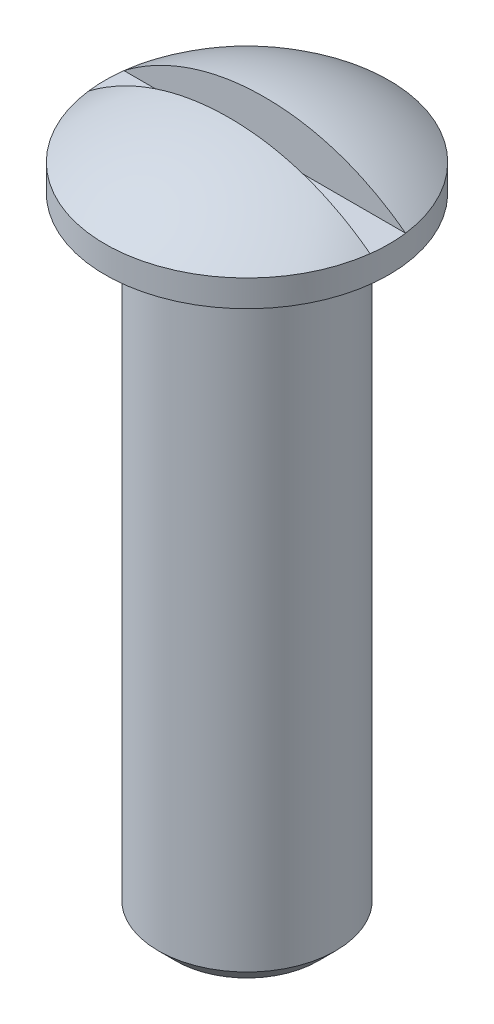
from build123d import *

# Parameters (mm, degrees)
SFAZOWANIE1_SIZE           = 1
SZKIC5_W                   = 16
SZKIC5_H                   = 2
WYTNIJ_WYCI_GNI_CIE7_DEPTH = 39.691084286


with BuildPart() as part:
    # Szkic1 → Obrót1 (revolve)
    with BuildSketch(Plane.XY):
        with BuildLine():
            Line((0, 0), (5, 0))
            Line((5, 0), (5, 35.5))
            Line((5, 35.5), (8, 35.5))
            Line((8, 35.5), (8, 37))
            ThreePointArc((8, 37), (4.225307725, 39.017578445), (0, 39.7))
            Line((0, 39.7), (0, 0))
        make_face()
    revolve(axis=Axis((0, 0, 0), (0, 1, 0)))

    # Sfazowanie1
    sfazowanie1_edges = [part.edges().sort_by_distance(p)[0] for p in [
        (-5, 0, 0),
    ]]
    chamfer(sfazowanie1_edges, length=SFAZOWANIE1_SIZE)

    # Szkic5 → Wytnij-wyciągnięcie7 (cut, through all)
    with BuildSketch(Plane(origin=(0, 37, 0), x_dir=(1, 0, 0), z_dir=(0, 1, 0))):
        Rectangle(SZKIC5_W, SZKIC5_H)
    extrude(amount=WYTNIJ_WYCI_GNI_CIE7_DEPTH, mode=Mode.SUBTRACT)


solid = part.part
